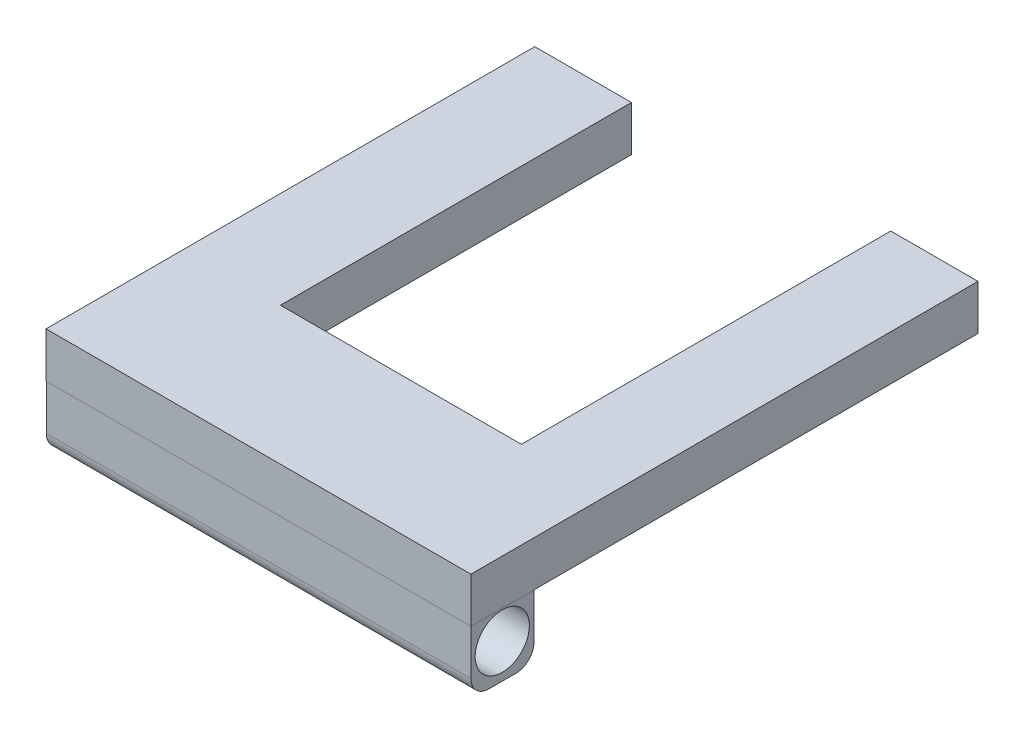
from build123d import *

# Parameters (mm, degrees)
BOSS_EXTRUDE1_DEPTH = 5
SKETCH2_W           = 7
SKETCH2_H           = 7
BOSS_EXTRUDE2_DEPTH = 47
SKETCH5_R           = 3
CUT_EXTRUDE1_DEPTH  = 47
FILLET2_R           = 2


with BuildPart() as part:
    # Sketch1 → Boss-Extrude1 (new body)
    with BuildSketch(Plane(origin=(0, 0, 0), x_dir=(1, 0, 0), z_dir=(0, 1, 0))):
        Polygon((0, 0), (0, -54.102), (47.029678449, -54.102), (47.029678449, 2.032), (37.377678449, 2.032), (37.377678449, -38.862), (10.707678449, -38.862), (10.707678449, 0), align=None)
    extrude(amount=BOSS_EXTRUDE1_DEPTH)


with BuildPart() as body_2:
    # Sketch2 → Boss-Extrude2 (new body)
    with BuildSketch(Plane(origin=(47.029678449, 0, 0), x_dir=(0, 0, -1), z_dir=(1, 0, 0))):
        with Locations((-50.602, -3.5)):
            Rectangle(SKETCH2_W, SKETCH2_H)
    extrude(amount=-BOSS_EXTRUDE2_DEPTH)

    # Sketch5 → Cut-Extrude1 (cut)
    with BuildSketch(Plane(origin=(47.029678449, 0, 0), x_dir=(0, 0, -1), z_dir=(1, 0, 0))):
        with Locations((-50.626343161, -3.154860788)):
            Circle(SKETCH5_R)
    extrude(amount=-CUT_EXTRUDE1_DEPTH, mode=Mode.SUBTRACT)

    # Fillet2
    fillet2_edges = [body_2.edges().sort_by_distance(p)[0] for p in [
        (23.529678449, -7, 47.102),
        (23.529678449, -7, 54.102),
    ]]
    fillet(fillet2_edges, radius=FILLET2_R)


solid = Compound([part.part, body_2.part])
